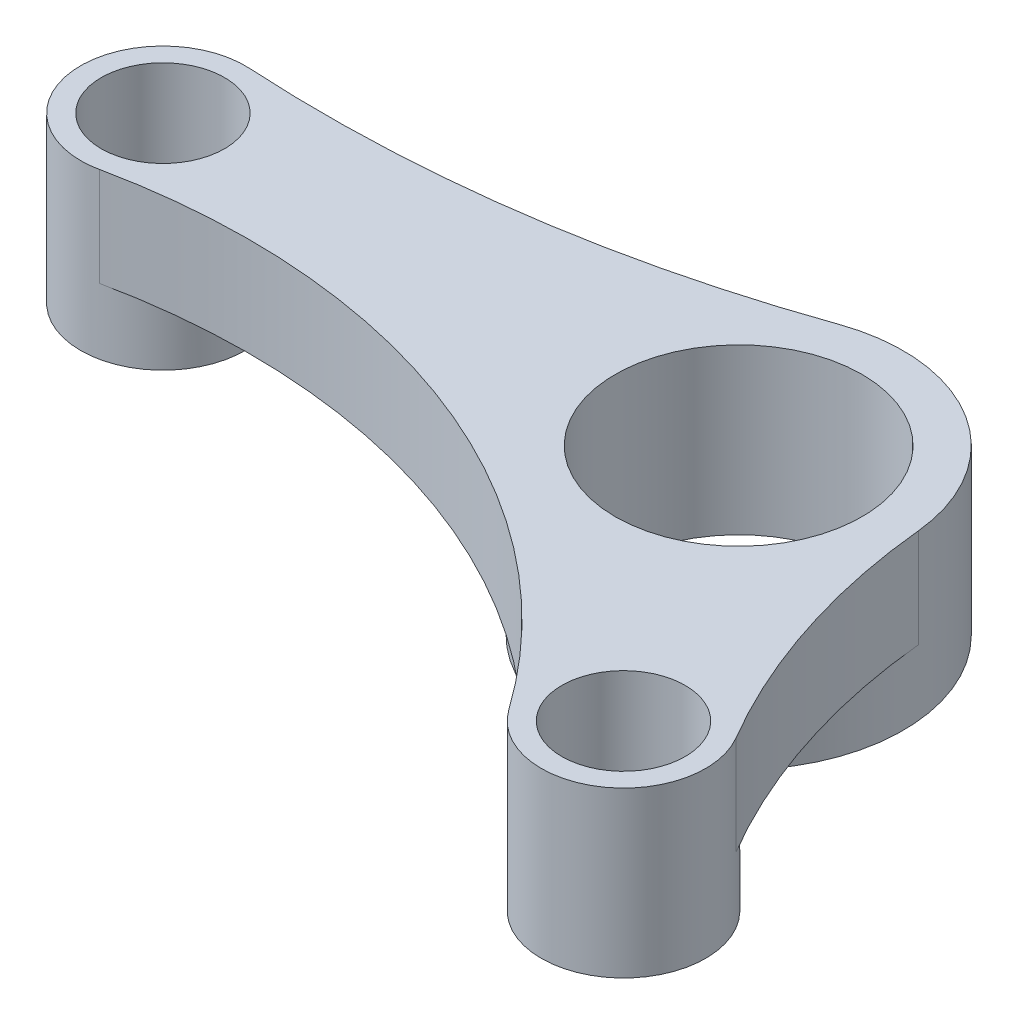
from build123d import *
from build123d.topology import SkipClean

# Parameters (mm, degrees)
SKETCH1_R             = 20
SKETCH1_R_2           = 15
BOSS_EXTRUDE1_DEPTH   = 20
SKETCH1_R_3           = 10
SKETCH1_R_4           = 7.5
BOSS_EXTRUDE1_2_DEPTH = 20
BOSS_EXTRUDE1_3_DEPTH = 20
BOSS_EXTRUDE2_START   = -12
SKETCH3_R             = 7.5
SKETCH3_R_2           = 15
BOSS_EXTRUDE2_DEPTH   = 12
CUT_EXTRUDE3_DEPTH    = 12


with BuildPart() as part:
    # Sketch1 → Boss-Extrude1 (new body)
    with BuildSketch(Plane(origin=(0, 0, 0), x_dir=(1, 0, 0), z_dir=(0, 1, 0))):
        with Locations(Location((0, 0, 0), (0, 0, 270))):
            Circle(SKETCH1_R)
        with Locations(Location((0, 0, 0), (0, 0, 270))):
            Circle(SKETCH1_R_2, mode=Mode.SUBTRACT)
    extrude(amount=BOSS_EXTRUDE1_DEPTH)



with BuildPart() as body_2:
    # Sketch1 → Boss-Extrude1 2 (new body)
    with BuildSketch(Plane(origin=(0, 0, 0), x_dir=(1, 0, 0), z_dir=(0, 1, 0))):
        with Locations(Location((-70, 0, 0), (0, 0, 270))):
            Circle(SKETCH1_R_3)
        with Locations(Location((-70, 0, 0), (0, 0, 270))):
            Circle(SKETCH1_R_4, mode=Mode.SUBTRACT)
    extrude(amount=BOSS_EXTRUDE1_2_DEPTH)


with BuildPart() as body_3:
    # Sketch1 → Boss-Extrude1 3 (new body)
    with BuildSketch(Plane(origin=(0, 0, 0), x_dir=(1, 0, 0), z_dir=(0, 1, 0))):
        with Locations(Location((22, -36, 0), (0, 0, 270))):
            Circle(SKETCH1_R_3)
        with Locations(Location((22, -36, 0), (0, 0, 270))):
            Circle(SKETCH1_R_4, mode=Mode.SUBTRACT)
    extrude(amount=BOSS_EXTRUDE1_3_DEPTH)


with BuildPart() as part_1:
    add(part.part)

    add(body_2.part)  # Boss-Extrude2 merges body 2

    add(body_3.part)  # Boss-Extrude2 merges body 3
    # Sketch3 → Boss-Extrude2 (add)
    with BuildSketch(Plane(origin=(0, 20, 0), x_dir=(1, 0, 0), z_dir=(0, 1, 0)).offset(BOSS_EXTRUDE2_START)):
        with BuildLine():
            ThreePointArc((-69.411764706, 9.98268397), (-79.972209179, -0.745012818), (-67.934982867, -9.784462389))
            ThreePointArc((-67.934982867, -9.784462389), (-22.262897918, -13.560739124), (13.842794911, -41.784462389))
            ThreePointArc((13.842794911, -41.784462389), (27.436542927, -44.393092457), (30.614150003, -30.920982406))
            ThreePointArc((30.614150003, -30.920982406), (23.463789692, -15.074619609), (19.905470006, 1.94223167))
            ThreePointArc((19.905470006, 1.94223167), (10.739501735, 16.871962022), (-6.666666667, 18.856180832))
            ThreePointArc((-6.666666667, 18.856180832), (-37.595518656, 11.282020609), (-69.411764706, 9.98268397))
        make_face()
        with Locations(Location((22, -36, 0), (0, 0, 270))):
            Circle(SKETCH3_R, mode=Mode.SUBTRACT)
        with Locations(Location((0, 0, 0), (0, 0, 270))):
            Circle(SKETCH3_R_2, mode=Mode.SUBTRACT)
        with Locations(Location((-70, 0, 0), (0, 0, 270))):
            Circle(SKETCH3_R, mode=Mode.SUBTRACT)
    extrude(amount=BOSS_EXTRUDE2_DEPTH)

    # Sketch7 → Cut-Extrude3 (cut)
    with SkipClean():  # the faces are left unmerged after this step: merging them gives an invalid solid
        with BuildSketch(Plane.XZ):
            with BuildLine():
                ThreePointArc((-61.791440547, 5.711352878), (-37.607048321, 6.216745586), (-14.595467543, 13.673782476))
                ThreePointArc((-14.595467543, 13.673782476), (-19.994557018, 0.466572242), (-15.217388241, -12.978100598))
                ThreePointArc((-15.217388241, -12.978100598), (-38.678450916, -8.106148696), (-62.600273301, -6.72636936))
                ThreePointArc((-62.600273301, -6.72636936), (-60.021078075, -0.648935452), (-61.791440547, 5.711352878))
            make_face()
            with BuildLine():
                ThreePointArc((24.793712928, 26.398168504), (21.047204692, 17.304888513), (18.402586233, 7.832293401))
                ThreePointArc((18.402586233, 7.832293401), (8.963679846, 17.878826685), (-4.733552286, 19.431764787))
                ThreePointArc((-4.733552286, 19.431764787), (4.201963756, 26.450336843), (12.095188973, 34.623512255))
                ThreePointArc((12.095188973, 34.623512255), (16.563457073, 27.606907543), (24.793712928, 26.398168504))
            make_face()
        extrude(amount=-CUT_EXTRUDE3_DEPTH, mode=Mode.SUBTRACT)


solid = part_1.part
